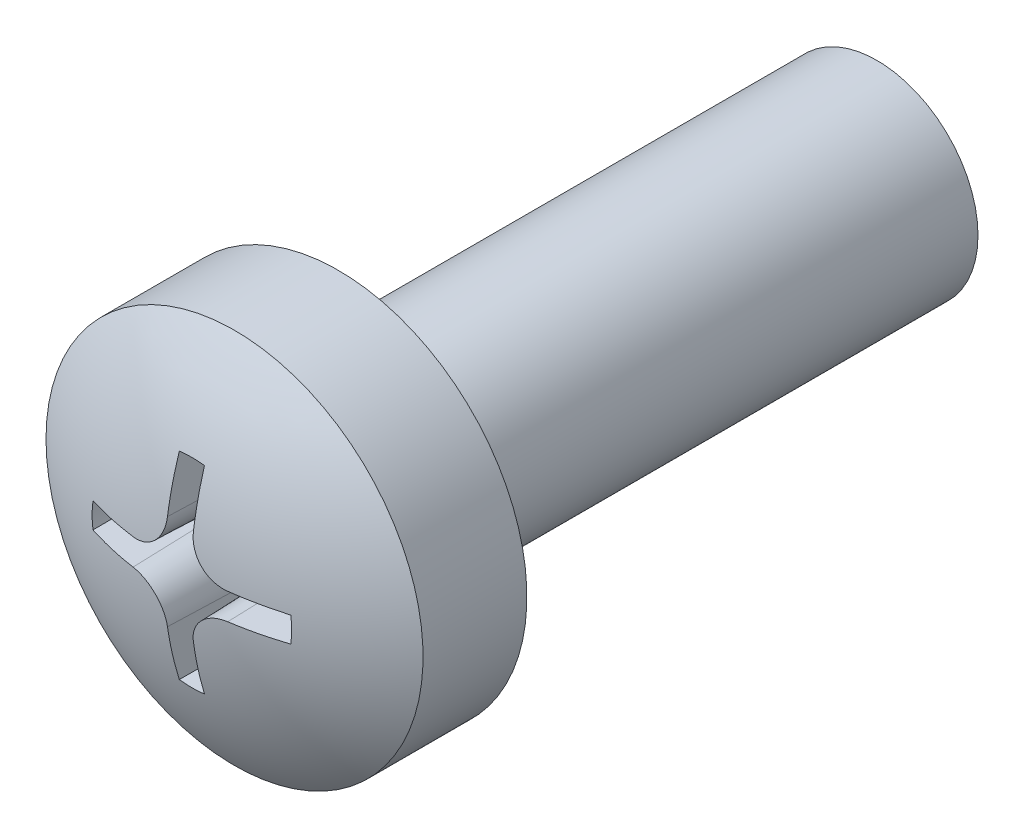
from build123d import *

# Parameters (mm, degrees)
SKETCH1_R          = 1.5
BASE_EXTRUDE_DEPTH = 8
CUT_EXTRUDE1_DEPTH = 1.799999969
CUT_EXTRUDE1_TAPER = 2


with BuildPart() as part:
    # Sketch1 → Base-Extrude (new body)
    with BuildSketch(Plane.XY):
        Circle(SKETCH1_R)
    extrude(amount=BASE_EXTRUDE_DEPTH)

    # Sketch6 → Boss-Revolve2 (revolve)
    with BuildSketch(Plane(origin=(0, 0, 0), x_dir=(1, 0, 0), z_dir=(0, 1, 0)), mode=Mode.PRIVATE) as boss_revolve2_sk:
        with BuildLine():
            Line((0, -8), (2.7999999, -8))
            Line((2.7999999, -8), (2.7999999, -9.54246308))
            ThreePointArc((2.7999999, -9.54246308), (1.46418655, -10.180811406), (0, -10.4))
            Line((0, -10.4), (0, -8))
        make_face()
    revolve(boss_revolve2_sk.sketch.rotate(Axis((0, 0, -0.393620135), (0, 0, 1)), 180), axis=Axis((0, 0, -0.393620135), (0, 0, 1)))

    # Sketch7 → Cut-Extrude1 (cut)
    with BuildSketch(Plane(origin=(0, 0, 10.7000001), x_dir=(-1, 0, 0), z_dir=(0, 0, -1))):
        with BuildLine():
            ThreePointArc((0.205000004, 1.48592565), (0, 1.500000013), (-0.205000004, 1.48592565))
            Line((-0.205000004, 1.48592565), (-0.205000004, 0.708178558))
            ThreePointArc((-0.205000004, 0.708178558), (-0.35072876, 0.355344481), (-0.702967546, 0.208182689))
            Line((-0.702967546, 0.208182689), (-1.48592565, 0.205000004))
            ThreePointArc((-1.48592565, 0.205000004), (-1.500000013, 0), (-1.48592565, -0.205000004))
            Line((-1.48592565, -0.205000004), (-0.702967546, -0.208182689))
            ThreePointArc((-0.702967546, -0.208182689), (-0.35072876, -0.355344481), (-0.205000004, -0.708178558))
            Line((-0.205000004, -0.708178558), (-0.205000004, -1.48592565))
            ThreePointArc((-0.205000004, -1.48592565), (0, -1.500000013), (0.205000004, -1.48592565))
            Line((0.205000004, -1.48592565), (0.205000004, -0.708178558))
            ThreePointArc((0.205000004, -0.708178558), (0.35072876, -0.355344481), (0.702967546, -0.208182689))
            Line((0.702967546, -0.208182689), (1.48592565, -0.205000004))
            ThreePointArc((1.48592565, -0.205000004), (1.500000013, 0), (1.48592565, 0.205000004))
            Line((1.48592565, 0.205000004), (0.702967546, 0.208182689))
            ThreePointArc((0.702967546, 0.208182689), (0.35072876, 0.355344481), (0.205000004, 0.708178558))
            Line((0.205000004, 0.708178558), (0.205000004, 1.48592565))
        make_face()
    extrude(amount=CUT_EXTRUDE1_DEPTH, taper=CUT_EXTRUDE1_TAPER, mode=Mode.SUBTRACT)


solid = part.part
